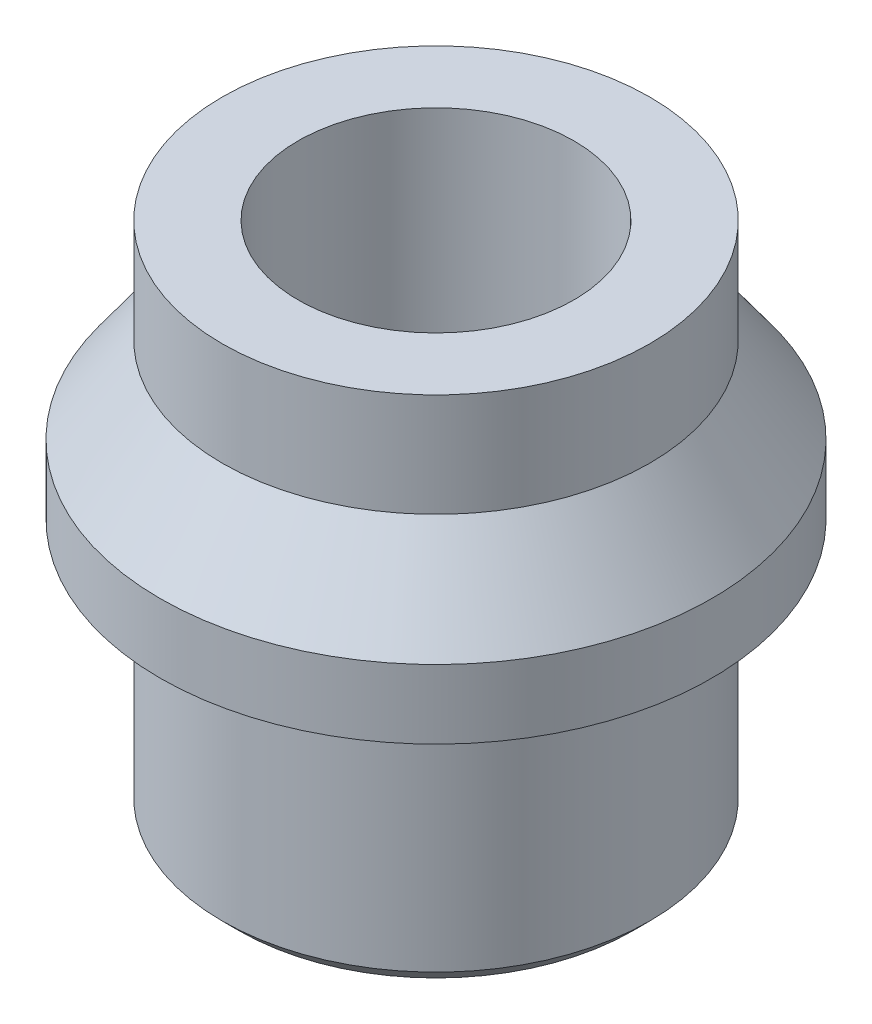
from build123d import *

# Parameters (mm, degrees)
CHAMFER1_SIZE = 0.5


with BuildPart() as part:
    # Sketch1 → Revolve1 (revolve)
    with BuildSketch(Plane.XY, mode=Mode.PRIVATE) as revolve1_sk:
        Polygon((4, 0), (6.2, 0), (6.2, 7.5), (8, 7.5), (8, 9.5), (6.2, 12), (6.2, 15), (4, 15), align=None)
    revolve(revolve1_sk.sketch.rotate(Axis((0, 0, 0), (0, 1, 0)), 90), axis=Axis((0, 0, 0), (0, 1, 0)))

    # Chamfer1
    chamfer1_edges = [part.edges().sort_by_distance(p)[0] for p in [
        (0, 0, 6.2),
        (0, 0, 4),
    ]]
    chamfer(chamfer1_edges, length=CHAMFER1_SIZE)


solid = part.part
